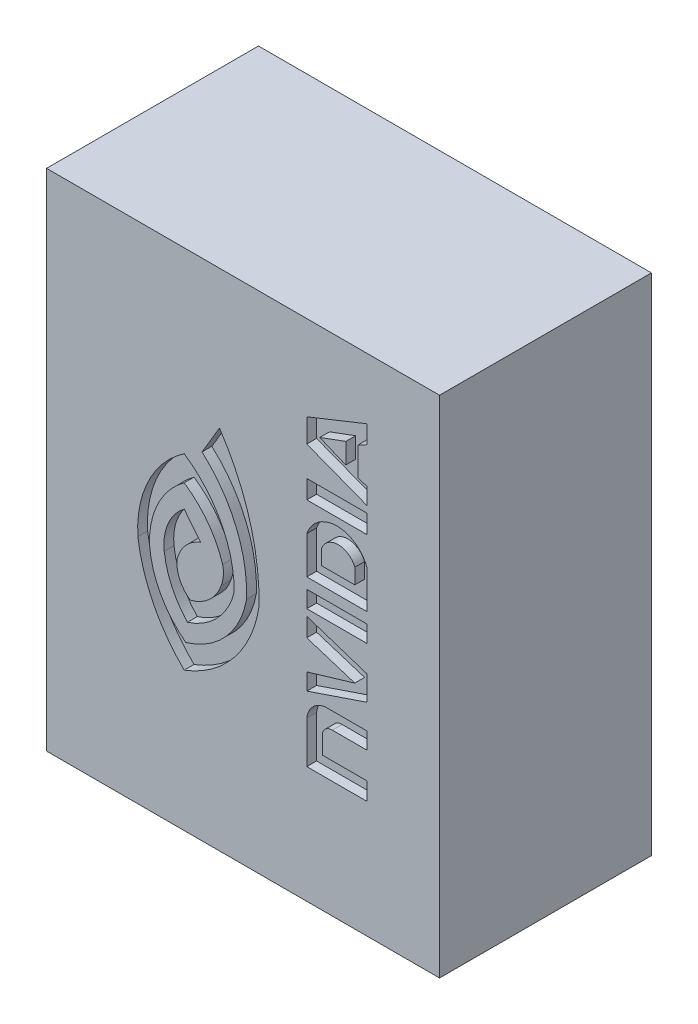
from build123d import *

# Parameters (mm, degrees)
SKETCH1_W           = 102
SKETCH1_H           = 55
BOSS_EXTRUDE1_DEPTH = 131
SKETCH2_W           = 15.67927859
SKETCH2_H           = 4.373721057
SKETCH2_H_2         = 4.820111396
CUT_EXTRUDE1_DEPTH  = 2.54


with BuildPart() as part:
    # Sketch1 → Boss-Extrude1 (new body)
    with BuildSketch(Plane(origin=(0, 0, 0), x_dir=(1, 0, 0), z_dir=(0, 1, 0))):
        Rectangle(SKETCH1_W, SKETCH1_H)
    extrude(amount=BOSS_EXTRUDE1_DEPTH)

    # Sketch2 → Cut-Extrude1 (cut)
    # profile 1 of 7: a face of its own
    with BuildSketch(Plane.XY.offset(27.5)):
        with BuildLine():
            Line((32.222685011, 30.289063801), (16.543406421, 30.289063801))
            Line((16.543406421, 30.289063801), (16.543406421, 41.213310419))
            ThreePointArc((16.543406421, 41.213310419), (18.071687856, 44.464476673), (21.263986447, 46.112188983))
            Line((21.263986447, 46.112188983), (32.222685011, 46.112188983))
            Line((32.222685011, 46.112188983), (32.222685011, 41.796791207))
            Line((32.222685011, 41.796791207), (23.173438966, 41.796791207))
            ThreePointArc((23.173438966, 41.796791207), (21.378356157, 41.143325428), (20.571111013, 39.411940118))
            Line((20.571111013, 39.411940118), (20.571111013, 34.892154763))
            Line((20.571111013, 34.892154763), (32.222685011, 34.892154763))
            Line((32.222685011, 34.892154763), (32.222685011, 30.289063801))
        make_face()
    # profile 2 of 7: a face of its own
    with BuildSketch(Plane.XY.offset(27.5)):
        Polygon((32.222685011, 58.914535722), (32.222685011, 52.585285649), (16.543406421, 47.262961724), (16.543406421, 51.578359501), (29.001278605, 55.294208224), (16.543406421, 59.244665953), (16.543406421, 64.088679598), align=None)
    # profile 3 of 7: a face of its own
    with BuildSketch(Plane.XY.offset(27.5)):
        with Locations((24.383045716, 67.968593438)):
            Rectangle(SKETCH2_W, SKETCH2_H)
    # profile 4 of 7: a face of its own
    with BuildSketch(Plane.XY.offset(27.5)):
        with BuildLine():
            Line((32.222685011, 72.930180229), (16.543406421, 72.930180229))
            Line((16.543406421, 72.930180229), (16.543406421, 82.665236776))
            ThreePointArc((16.543406421, 82.665236776), (24.383045716, 88.291485928), (32.222685011, 82.665236776))
            Line((32.222685011, 82.665236776), (32.222685011, 72.930180229))
        make_face()
        with BuildLine():
            Line((20.335941045, 81.186975839), (20.335941045, 77.367606352))
            Line((20.335941045, 77.367606352), (29.001278605, 77.367606352))
            Line((29.001278605, 77.367606352), (29.001278605, 81.318517332))
            ThreePointArc((29.001278605, 81.318517332), (24.622917057, 84.262772166), (20.335941045, 81.186975839))
        make_face(mode=Mode.SUBTRACT)
    # profile 5 of 7: a face of its own
    with BuildSketch(Plane.XY.offset(27.5)):
        with Locations((24.383045716, 92.657631845)):
            Rectangle(SKETCH2_W, SKETCH2_H_2)
    # profile 6 of 7: a face of its own
    with BuildSketch(Plane.XY.offset(27.5)):
        Polygon((32.222685011, 96.757683119), (32.222685011, 101.073072233), (29.843242059, 101.863254429), (29.843242059, 109.239047859), (32.222685011, 110.484071773), (32.222685011, 115.184037049), (16.543406421, 108.92779188), (16.543406421, 102.796049103), align=None)
        Polygon((26.661750428, 108.457670817), (19.906160177, 105.955600354), (26.661750428, 103.153281435), align=None, mode=Mode.SUBTRACT)
    # profile 7 of 7: a face of its own
    with BuildSketch(Plane.XY.offset(27.5)):
        with BuildLine():
            Line((-6.115743329, 95.067687543), (-10.640576822, 87.427905373))
            ThreePointArc((-10.640576822, 87.427905373), (-1.813234505, 75.031176459), (0.903633442, 60.057216105))
            ThreePointArc((0.903633442, 60.057216105), (-4.465154431, 49.019149341), (-14.864068382, 42.497999922))
            ThreePointArc((-14.864068382, 42.497999922), (-21.425458539, 50.136520198), (-24.276421001, 59.794203453))
            ThreePointArc((-24.276421001, 59.794203453), (-22.06840901, 70.110226473), (-15.269017603, 78.17644767))
            ThreePointArc((-15.269017603, 78.17644767), (-9.151476423, 72.34247097), (-5.290820846, 64.822169595))
            ThreePointArc((-5.290820846, 64.822169595), (-5.118898357, 62.277928614), (-5.69667759, 59.794203453))
            ThreePointArc((-5.69667759, 59.794203453), (-8.801475151, 55.16826153), (-13.737803966, 52.585285649))
            ThreePointArc((-13.737803966, 52.585285649), (-16.38620677, 55.748861503), (-17.197044672, 59.794203453))
            ThreePointArc((-17.197044672, 59.794203453), (-15.016123652, 64.139522978), (-11.03158578, 66.925501483))
            Line((-11.03158578, 66.925501483), (-15.269017603, 72.262107708))
            ThreePointArc((-15.269017603, 72.262107708), (-19.465910752, 66.925501483), (-20.457305995, 60.20907285))
            ThreePointArc((-20.457305995, 60.20907285), (-18.493685046, 53.244585471), (-14.421821953, 47.262961724))
            ThreePointArc((-14.421821953, 47.262961724), (-6.68710858, 52.075713319), (-2.295755467, 60.057216105))
            ThreePointArc((-2.295755467, 60.057216105), (-5.69667759, 74.012425991), (-15.269380997, 84.721184263))
            ThreePointArc((-15.269380997, 84.721184263), (-24.537703565, 73.975429659), (-27.304719411, 60.057216105))
            ThreePointArc((-27.304719411, 60.057216105), (-23.293771998, 47.057349301), (-15.269380997, 36.07129518))
            ThreePointArc((-15.269380997, 36.07129518), (-2.295755467, 45.418962155), (4.139721094, 60.057216105))
            ThreePointArc((4.139721094, 60.057216105), (1.703886183, 78.350977538), (-6.115743329, 95.067687543))
        make_face()
    extrude(amount=-CUT_EXTRUDE1_DEPTH, mode=Mode.SUBTRACT)


solid = part.part
